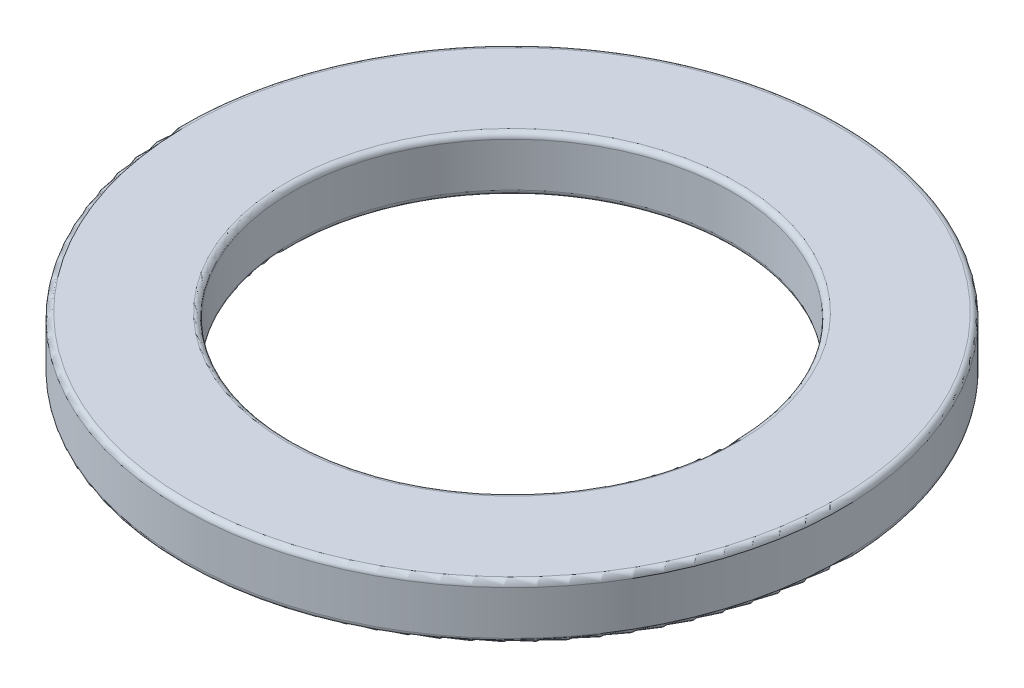
from build123d import *

# Parameters (mm, degrees)
SKETCH1_R           = 30
SKETCH1_R_2         = 20
BOSS_EXTRUDE1_DEPTH = 5
FILLET1_R           = 0.5


with BuildPart() as part:
    # Sketch1 → Boss-Extrude1 (new body)
    with BuildSketch(Plane(origin=(0, 0, 0), x_dir=(1, 0, 0), z_dir=(0, 1, 0))):
        with Locations(Location((0, 0, 0), (0, 0, 270))):
            Circle(SKETCH1_R)
        with Locations(Location((0, 0, 0), (0, 0, 270))):
            Circle(SKETCH1_R_2, mode=Mode.SUBTRACT)
    extrude(amount=BOSS_EXTRUDE1_DEPTH)

    # Fillet1
    fillet1_edges = [part.edges().sort_by_distance(p)[0] for p in [
        (0, 0, -30),
        (0, 5, -30),
        (0, 0, -20),
        (0, 5, -20),
    ]]
    fillet(fillet1_edges, radius=FILLET1_R)


solid = part.part
